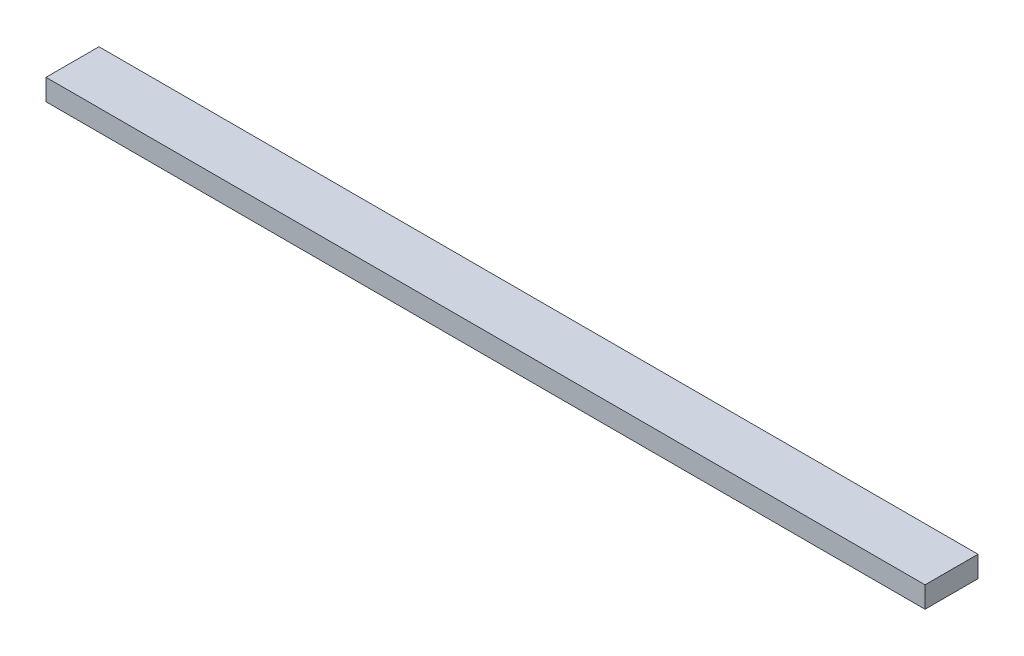
from build123d import *

# Parameters (mm, degrees)
SKETCH_1_W      = 415
SKETCH_1_H      = 25
EXTRUDE_1_DEPTH = 10


with BuildPart() as part:
    # Эскиз1 → Бобышка-Вытянуть1 (new body)
    with BuildSketch(Plane(origin=(0, 0, 0), x_dir=(1, 0, 0), z_dir=(0, 1, 0))):
        with Locations((207.5, 12.5)):
            Rectangle(SKETCH_1_W, SKETCH_1_H)
    extrude(amount=EXTRUDE_1_DEPTH)


solid = part.part
